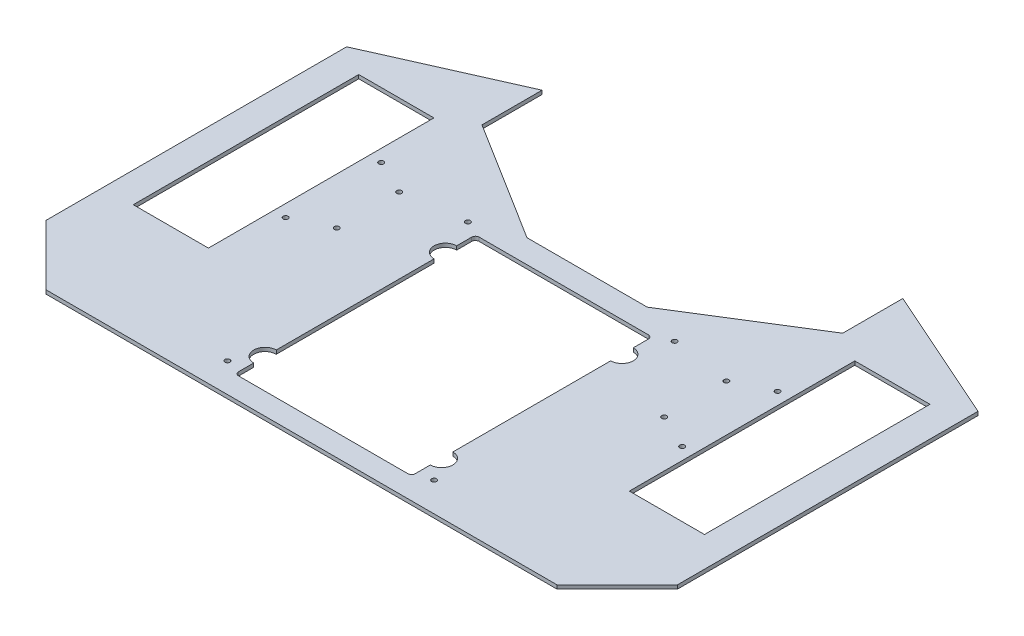
from build123d import *

# Parameters (mm, degrees)
SKETCH1_W           = 63.5
SKETCH1_H           = 190.5
BOSS_EXTRUDE1_DEPTH = 3.175
SKETCH3_R           = 2.0828
CUT_EXTRUDE2_DEPTH  = 526.850378691
SKETCH4_R           = 2.0828
CUT_EXTRUDE4_DEPTH  = 526.850378691
FILLET2_R           = 3.175


with BuildPart() as part:
    # Sketch1 → Boss-Extrude1 (new body)
    with BuildSketch(Plane(origin=(0, 0, 0), x_dir=(1, 0, 0), z_dir=(0, 1, 0))):
        Polygon((-242.686835374, -133.432512515), (-242.686835374, -385.491221995), (-242.686835374, -387.371651362), (-191.886835374, -438.171651362), (239.913164626, -438.171651362), (290.713164626, -387.371651362), (290.713164626, -133.371651362), (176.413164626, -82.571651362), (176.413164626, -133.371651362), (74.813164626, -196.871651362), (-26.786835374, -196.871651362), (-128.386835374, -133.371651362), (-128.386835374, -82.571651362), (-242.686835374, -133.371651362), align=None)
        with Locations((233.563164626, -243.80020948)):
            Rectangle(SKETCH1_W, SKETCH1_H, mode=Mode.SUBTRACT)
        with Locations((-185.536835374, -243.80020948)):
            Rectangle(SKETCH1_W, SKETCH1_H, mode=Mode.SUBTRACT)
    extrude(amount=BOSS_EXTRUDE1_DEPTH)

    # Sketch3 → Cut-Extrude2 (cut, through all)
    with BuildSketch(Plane(origin=(0, 0, 0), x_dir=(1, 0, 0), z_dir=(0, 1, 0))):
        with Locations(Location((-114.278235374, -270.125471314, 0), (0, 0, 270))):
            Circle(SKETCH3_R)
        with Locations(Location((-143.449035374, -284.13540948, 0), (0, 0, 270))):
            Circle(SKETCH3_R)
        with Locations(Location((-114.278235374, -217.474947647, 0), (0, 0, 270))):
            Circle(SKETCH3_R)
        with Locations(Location((-143.449035374, -203.46500948, 0), (0, 0, 270))):
            Circle(SKETCH3_R)
        with Locations(Location((191.475364626, -284.13540948, 0), (0, 0, 270))):
            Circle(SKETCH3_R)
        with Locations(Location((162.304564626, -270.125471314, 0), (0, 0, 270))):
            Circle(SKETCH3_R)
        with Locations(Location((162.304564626, -217.474947647, 0), (0, 0, 270))):
            Circle(SKETCH3_R)
        with Locations(Location((191.475364626, -203.46500948, 0), (0, 0, 270))):
            Circle(SKETCH3_R)
    extrude(amount=CUT_EXTRUDE2_DEPTH, mode=Mode.SUBTRACT)

    # Sketch4 → Cut-Extrude4 (cut, through all)
    with BuildSketch(Plane(origin=(0, 0, 0), x_dir=(1, 0, 0), z_dir=(0, 1, 0))):
        with Locations(Location((111.325664626, -210.298576853, 0), (0, 0, 270))):
            Circle(SKETCH4_R)
        with Locations(Location((111.325664626, -413.498576853, 0), (0, 0, 270))):
            Circle(SKETCH4_R)
        with Locations(Location((-63.299335374, -413.498576853, 0), (0, 0, 90))):
            Circle(SKETCH4_R)
        with Locations(Location((-63.299335374, -210.298576853, 0), (0, 0, 90))):
            Circle(SKETCH4_R)
        with BuildLine():
            Line((-50.599335374, -216.648576853), (98.625664626, -216.648576853))
            Line((98.625664626, -216.648576853), (98.625664626, -232.523576853))
            ThreePointArc((98.625664626, -232.523576853), (108.150664626, -242.048576853), (98.625664626, -251.573576853))
            Line((98.625664626, -251.573576853), (98.625664626, -384.923576853))
            ThreePointArc((98.625664626, -384.923576853), (108.150664626, -394.448576853), (98.625664626, -403.973576853))
            Line((98.625664626, -403.973576853), (98.625664626, -419.848576853))
            Line((98.625664626, -419.848576853), (-50.599335374, -419.848576853))
            Line((-50.599335374, -419.848576853), (-50.599335374, -403.973576853))
            ThreePointArc((-50.599335374, -403.973576853), (-60.124335374, -394.448576853), (-50.599335374, -384.923576853))
            Line((-50.599335374, -384.923576853), (-50.599335374, -251.573576853))
            ThreePointArc((-50.599335374, -251.573576853), (-60.124335374, -242.048576853), (-50.599335374, -232.523576853))
            Line((-50.599335374, -232.523576853), (-50.599335374, -216.648576853))
        make_face()
    extrude(amount=CUT_EXTRUDE4_DEPTH, mode=Mode.SUBTRACT)

    # Fillet2
    fillet2_edges = [part.edges().sort_by_distance(p)[0] for p in [
        (98.625664626, 1.5875, 419.848576853),
        (98.625664626, 1.5875, 216.648576853),
        (-50.599335374, 1.5875, 216.648576853),
        (-50.599335374, 1.5875, 419.848576853),
    ]]
    fillet(fillet2_edges, radius=FILLET2_R)


solid = part.part
